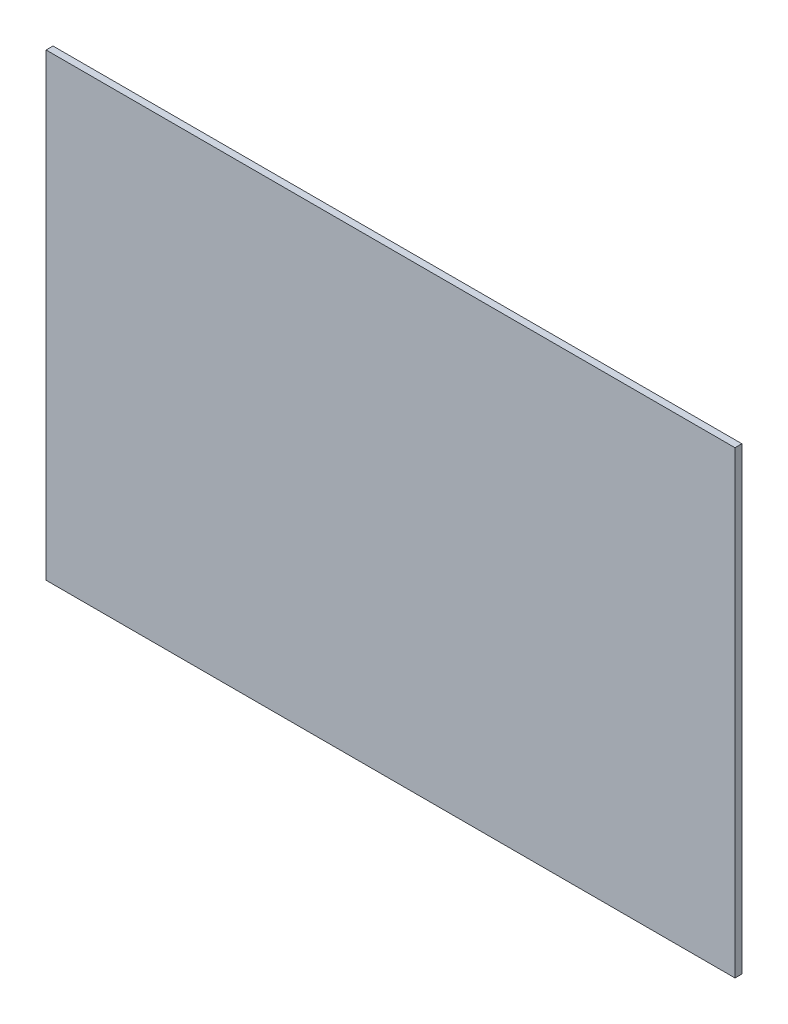
from build123d import *

# Parameters (mm, degrees)
CROQUIS1_W              = 300
CROQUIS1_H              = 200
SALIENTE_EXTRUIR1_DEPTH = 3


with BuildPart() as part:
    # Croquis1 → Saliente-Extruir1 (new body)
    with BuildSketch(Plane.XY):
        Rectangle(CROQUIS1_W, CROQUIS1_H)
    extrude(amount=SALIENTE_EXTRUIR1_DEPTH)


solid = part.part
